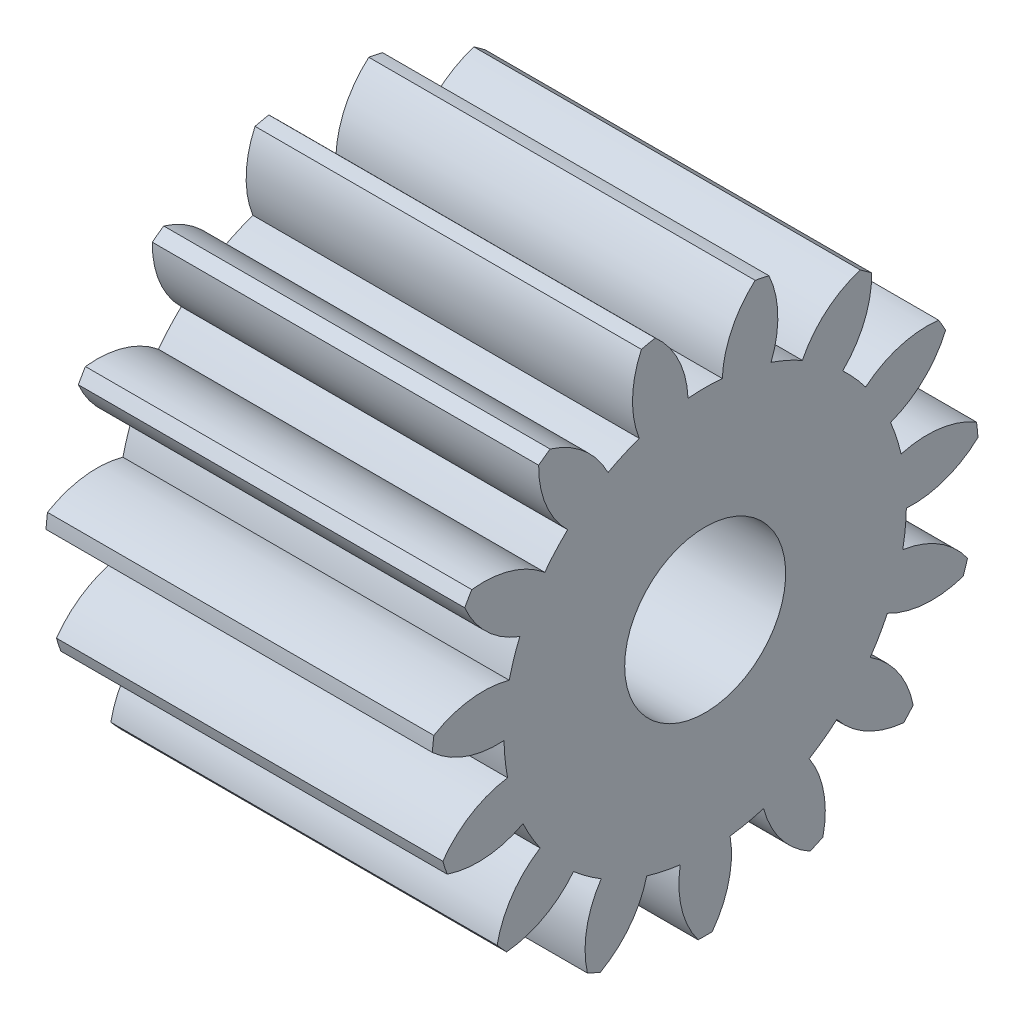
from build123d import *

# Parameters (mm, degrees)
BASPROSKE_W     = 12
BASPROSKE_H     = 8.5
TOOTHCUT_DEPTH  = 17.985287751
TEETHCUTS_COUNT = 15
TEETHCUTS_ANGLE = 336
BORSKE_R        = 2.5
BORE_DEPTH      = 50.0000508


with BuildPart() as part:
    # BasProSke → Base-Revolve (revolve)
    with BuildSketch(Plane(origin=(0, 0, 0), x_dir=(1, 0, 0), z_dir=(0, 1, 0)), mode=Mode.PRIVATE) as base_revolve_sk:
        with Locations((6, 4.25)):
            Rectangle(BASPROSKE_W, BASPROSKE_H)
    revolve(base_revolve_sk.sketch.rotate(Axis((-10, 0, 0), (1, 0, 0)), 180), axis=Axis((-10, 0, 0), (1, 0, 0)))

    # TooCutSke → ToothCut (cut, through all)
    with BuildSketch(Plane(origin=(0, 0, 0), x_dir=(0, 0, -1), z_dir=(1, 0, 0))):
        with BuildLine():
            ThreePointArc((0.531576138, 6.226349477), (0, 6.249), (-0.531576138, 6.226349477))
            ThreePointArc((-0.531576138, 6.226349477), (-0.830301624, 7.411024729), (-1.576608494, 8.378350125))
            ThreePointArc((-1.576608494, 8.378350125), (0, 8.5254), (1.576608494, 8.378350125))
            ThreePointArc((1.576608494, 8.378350125), (0.830301624, 7.411024729), (0.531576138, 6.226349477))
        make_face()
    toothcut = extrude(amount=TOOTHCUT_DEPTH, mode=Mode.SUBTRACT)

    # TeethCuts: ToothCut ×15 about axis
    teethcuts_axis = Axis((-10, 0, 0), (1, 0, 0))
    for i in range(1, TEETHCUTS_COUNT):
        add(toothcut.rotate(teethcuts_axis, i * TEETHCUTS_ANGLE / (TEETHCUTS_COUNT - 1)), mode=Mode.SUBTRACT)

    # BorSke → Bore (cut, symmetric)
    with BuildSketch(Plane(origin=(0, 0, 0), x_dir=(0, 0, -1), z_dir=(1, 0, 0))):
        with Locations(Location((0, 0, 0), (0, 0, 180))):
            Circle(BORSKE_R)
    extrude(amount=BORE_DEPTH, both=True, mode=Mode.SUBTRACT)


solid = part.part
